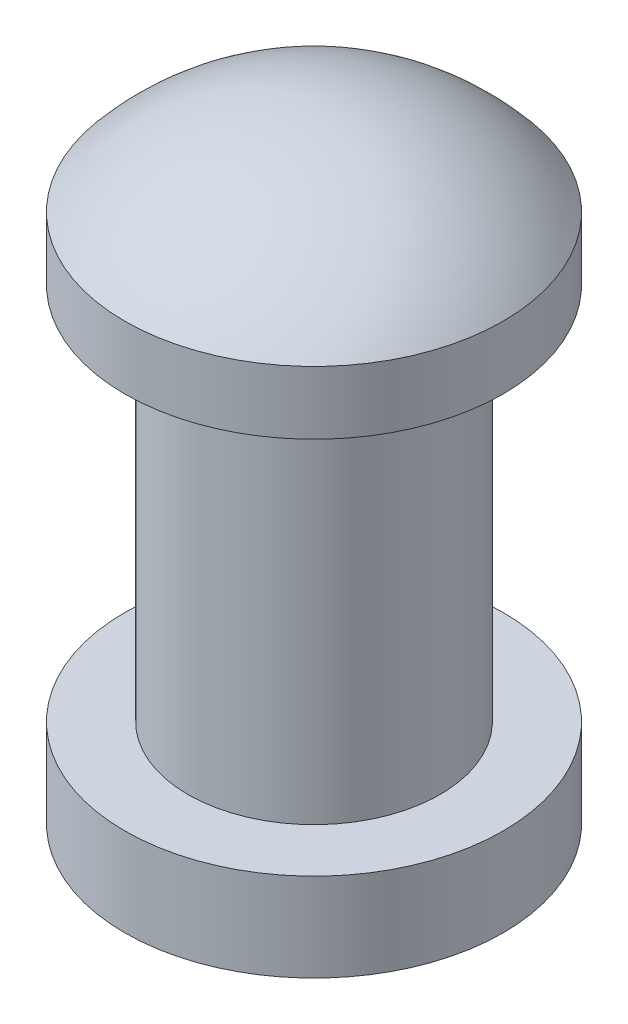
from build123d import *


with BuildPart() as part:
    # Sketch1 → Revolve1 (revolve)
    with BuildSketch(Plane.XY, mode=Mode.PRIVATE) as revolve1_sk:
        with BuildLine():
            Line((0.75, 1.65), (0.75, 1.4))
            Line((0.75, 1.4), (0.5, 1.4))
            Line((0.5, 1.4), (0.5, -0.1))
            Line((0.5, -0.1), (0.75, -0.1))
            Line((0.75, -0.1), (0.75, -0.45))
            Line((0.75, -0.45), (0, -0.45))
            Line((0, -0.45), (0, 2))
            ThreePointArc((0, 2), (0.413823634, 1.908193501), (0.75, 1.65))
        make_face()
    revolve(revolve1_sk.sketch.rotate(Axis((0, 2, 0), (0, -1, 0)), 90), axis=Axis((0, 2, 0), (0, -1, 0)))


solid = part.part
